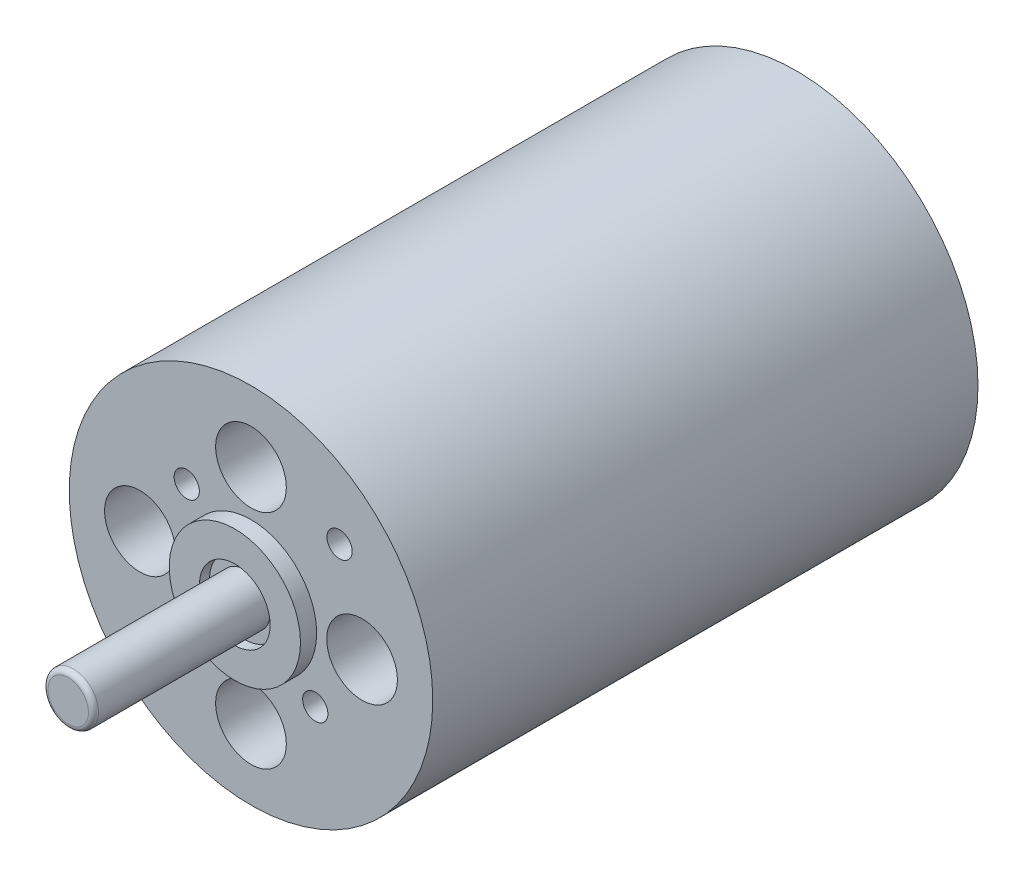
from build123d import *

# Parameters (mm, degrees)
ESBO_O1_R                = 18
RESSALTO_EXTRUS_O1_DEPTH = 27
ESBO_O7_R                = 3.5
ESBO_O7_R_2              = 3
CORTE_EXTRUS_O3_DEPTH    = 5
ESBO_O13_R               = 3.5
ESBO_O13_R_2             = 1.25
CORTE_EXTRUS_O4_DEPTH    = 5
ESBO_O14_R               = 6.5
RESSALTO_EXTRUS_O2_DEPTH = 1.6
RESSALTO_EXTRUS_O4_DEPTH = 7
CORTE_EXTRUS_O5_DEPTH    = 7
ESBO_O21_R               = 1.25
RESSALTO_EXTRUS_O5_DEPTH = 7
CORTE_EXTRUS_O6_START    = -1
ESBO_O22_R               = 3.5
CORTE_EXTRUS_O6_DEPTH    = 1
ESBO_O23_R               = 2.5
RESSALTO_EXTRUS_O6_DEPTH = 17.5
FILETE2_R                = 0.5


with BuildPart() as part:
    # Esboço1 → Ressalto-extrusão1 (new, symmetric)
    with BuildSketch(Plane.XY):
        Circle(ESBO_O1_R)
    extrude(amount=RESSALTO_EXTRUS_O1_DEPTH, both=True)

    # Esboço7 → Corte-extrusão3 (cut)
    with BuildSketch(Plane(origin=(0, 0, -27), x_dir=(-1, 0, 0), z_dir=(0, 0, -1))):
        Circle(ESBO_O7_R)
        with Locations((0, 11.5)):
            Circle(ESBO_O7_R_2)
        with Locations((-8.131727984, 8.131727984)):
            Circle(ESBO_O7_R_2)
        with Locations((-11.5, 0)):
            Circle(ESBO_O7_R_2)
        with Locations((-8.131727984, -8.131727984)):
            Circle(ESBO_O7_R_2)
        with Locations((8.131727984, -8.131727984)):
            Circle(ESBO_O7_R_2)
        with Locations((11.5, 0)):
            Circle(ESBO_O7_R_2)
        with Locations((8.131727984, 8.131727984)):
            Circle(ESBO_O7_R_2)
    extrude(amount=-CORTE_EXTRUS_O3_DEPTH, mode=Mode.SUBTRACT)

    # Esboço13 → Corte-extrusão4 (cut)
    with BuildSketch(Plane.XY.offset(27)):
        with Locations((-11, 0)):
            Circle(ESBO_O13_R)
        with Locations((11, 0)):
            Circle(ESBO_O13_R)
        with Locations((0, 11)):
            Circle(ESBO_O13_R)
        with Locations((0, -11)):
            Circle(ESBO_O13_R)
        with Locations((-8.768124087, -8.768124087)):
            Circle(ESBO_O13_R_2)
        with Locations((6.363961031, -6.363961031)):
            Circle(ESBO_O13_R_2)
        with Locations((-6.363961031, 6.363961031)):
            Circle(ESBO_O13_R_2)
        with Locations((8.768124087, 8.768124087)):
            Circle(ESBO_O13_R_2)
    extrude(amount=-CORTE_EXTRUS_O4_DEPTH, mode=Mode.SUBTRACT)

    # Esboço14 → Ressalto-extrusão2 (add)
    with BuildSketch(Plane.XY.offset(27)):
        Circle(ESBO_O14_R)
    extrude(amount=RESSALTO_EXTRUS_O2_DEPTH)

    # Esboço17 → Ressalto-extrusão4 (add)
    with BuildSketch(Plane(origin=(0, 0, -27), x_dir=(-1, 0, 0), z_dir=(0, 0, -1))):
        with BuildLine():
            ThreePointArc((-3.463586585, -14.296345868), (0, -14.709926486), (3.463586585, -14.296345868))
            ThreePointArc((3.463586585, -14.296345868), (4.825973045, -12.062760604), (2.592387781, -10.700374144))
            ThreePointArc((2.592387781, -10.700374144), (0, -11.009926486), (-2.592387781, -10.700374144))
            ThreePointArc((-2.592387781, -10.700374144), (-4.825973045, -12.062760604), (-3.463586585, -14.296345868))
        make_face()
    extrude(amount=RESSALTO_EXTRUS_O4_DEPTH)

    # Esboço18 → Corte-extrusão5 (cut)
    with BuildSketch(Plane(origin=(0, 0, -34), x_dir=(-1, 0, 0), z_dir=(0, 0, -1))):
        with BuildLine():
            ThreePointArc((-3.392948844, -14.004780593), (0, -14.409926486), (3.392948844, -14.004780593))
            ThreePointArc((3.392948844, -14.004780593), (4.53440777, -12.133398345), (2.663025521, -10.991939419))
            ThreePointArc((2.663025521, -10.991939419), (0, -11.309926486), (-2.663025521, -10.991939419))
            ThreePointArc((-2.663025521, -10.991939419), (-4.53440777, -12.133398345), (-3.392948844, -14.004780593))
        make_face()
    extrude(amount=-CORTE_EXTRUS_O5_DEPTH, mode=Mode.SUBTRACT)

    # Esboço21 → Ressalto-extrusão5 (add)
    with BuildSketch(Plane(origin=(0, 0, -27), x_dir=(-1, 0, 0), z_dir=(0, 0, -1))):
        with Locations((-3.027987183, -12.498360006)):
            Circle(ESBO_O21_R)
        with Locations((3.027987183, -12.498360006)):
            Circle(ESBO_O21_R)
        with Locations((0, -12.859926486)):
            Circle(ESBO_O21_R)
    extrude(amount=RESSALTO_EXTRUS_O5_DEPTH)

    # Esboço22 → Corte-extrusão6 (cut)
    with BuildSketch(Plane.XY.offset(28.6).offset(CORTE_EXTRUS_O6_START)):
        with Locations(Location((0, 0, 0), (0, 0, 180))):
            Circle(ESBO_O22_R)
    extrude(amount=CORTE_EXTRUS_O6_DEPTH, mode=Mode.SUBTRACT)

    # Esboço23 → Ressalto-extrusão6 (add)
    with BuildSketch(Plane.XY.offset(27.6)):
        Circle(ESBO_O23_R)
    extrude(amount=RESSALTO_EXTRUS_O6_DEPTH)

    # Filete2
    filete2_edges = [part.edges().sort_by_distance(p)[0] for p in [
        (-2.5, 0, 45.1),
    ]]
    fillet(filete2_edges, radius=FILETE2_R)


solid = part.part
